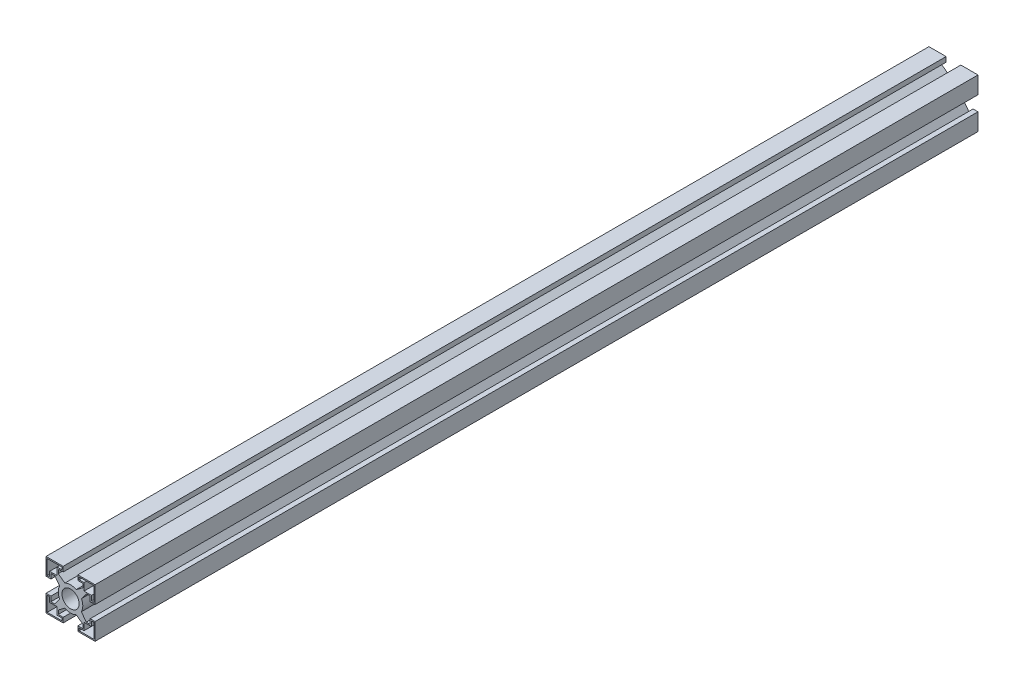
from build123d import *

# Parameters (mm, degrees)
ESQUISSE1_R        = 1.75
BOSS_EXTRU_1_DEPTH = 180


with BuildPart() as part:
    # Esquisse1 → Boss.-Extru.1 (new body)
    with BuildSketch(Plane.XY):
        with BuildLine():
            Line((-1.5, 5), (-5, 5))
            Line((-5, 5), (-5, 1.5))
            Line((-5, 1.5), (-4, 1.5))
            Line((-4, 1.5), (-4, 2.5))
            Line((-4, 2.5), (-3.207106781, 2.5))
            Line((-3.207106781, 2.5), (-2.216672281, 1.15601211))
            ThreePointArc((-2.216672281, 1.15601211), (-2.5, 0), (-2.216672281, -1.15601211))
            Line((-2.216672281, -1.15601211), (-3.207106781, -2.5))
            Line((-3.207106781, -2.5), (-4, -2.5))
            Line((-4, -2.5), (-4, -1.5))
            Line((-4, -1.5), (-5, -1.5))
            Line((-5, -1.5), (-5, -5))
            Line((-5, -5), (-1.5, -5))
            Line((-1.5, -5), (-1.5, -4))
            Line((-1.5, -4), (-2.5, -4))
            Line((-2.5, -4), (-2.5, -3.207106781))
            Line((-2.5, -3.207106781), (-1.15601211, -2.216672281))
            ThreePointArc((-1.15601211, -2.216672281), (0, -2.5), (1.15601211, -2.216672281))
            Line((1.15601211, -2.216672281), (2.5, -3.207106781))
            Line((2.5, -3.207106781), (2.5, -4))
            Line((2.5, -4), (1.5, -4))
            Line((1.5, -4), (1.5, -5))
            Line((1.5, -5), (5, -5))
            Line((5, -5), (5, -1.5))
            Line((5, -1.5), (4, -1.5))
            Line((4, -1.5), (4, -2.5))
            Line((4, -2.5), (3.207106781, -2.5))
            Line((3.207106781, -2.5), (2.216672281, -1.15601211))
            ThreePointArc((2.216672281, -1.15601211), (2.5, 0), (2.216672281, 1.15601211))
            Line((2.216672281, 1.15601211), (3.207106781, 2.5))
            Line((3.207106781, 2.5), (4, 2.5))
            Line((4, 2.5), (4, 1.5))
            Line((4, 1.5), (5, 1.5))
            Line((5, 1.5), (5, 5))
            Line((5, 5), (1.5, 5))
            Line((1.5, 5), (1.5, 4))
            Line((1.5, 4), (2.5, 4))
            Line((2.5, 4), (2.5, 3.207106781))
            Line((2.5, 3.207106781), (1.15601211, 2.216672281))
            ThreePointArc((1.15601211, 2.216672281), (0, 2.5), (-1.15601211, 2.216672281))
            Line((-1.15601211, 2.216672281), (-2.5, 3.207106781))
            Line((-2.5, 3.207106781), (-2.5, 4))
            Line((-2.5, 4), (-1.5, 4))
            Line((-1.5, 4), (-1.5, 5))
        make_face()
        Polygon((-4.75, 1.75), (-4.75, 4.75), (-1.75, 4.75), (-1.75, 4.25), (-2.75, 4.25), (-2.75, 2.75), (-4.25, 2.75), (-4.25, 1.75), align=None, mode=Mode.SUBTRACT)
        with Locations(Location((0, 0, 0), (0, 0, 180))):
            Circle(ESQUISSE1_R, mode=Mode.SUBTRACT)
        Polygon((-4.75, -4.75), (-4.75, -1.75), (-4.25, -1.75), (-4.25, -2.75), (-2.75, -2.75), (-2.75, -4.25), (-1.75, -4.25), (-1.75, -4.75), align=None, mode=Mode.SUBTRACT)
        Polygon((4.75, 4.75), (4.75, 1.75), (4.25, 1.75), (4.25, 2.75), (2.75, 2.75), (2.75, 4.25), (1.75, 4.25), (1.75, 4.75), align=None, mode=Mode.SUBTRACT)
        Polygon((4.75, -4.75), (1.75, -4.75), (1.75, -4.25), (2.75, -4.25), (2.75, -2.75), (4.25, -2.75), (4.25, -1.75), (4.75, -1.75), align=None, mode=Mode.SUBTRACT)
    extrude(amount=BOSS_EXTRU_1_DEPTH)


solid = part.part
